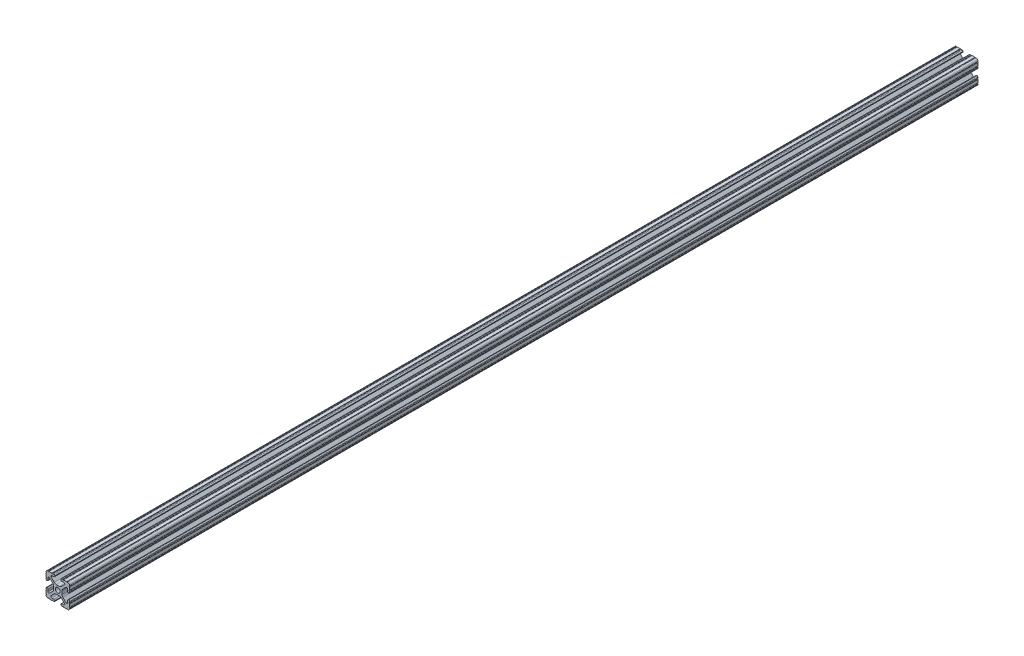
from build123d import *

# Parameters (mm, degrees)
SKETCH1_R           = 2.6035
BOSS_EXTRUDE1_DEPTH = 977.9


with BuildPart() as part:
    # Sketch1 → Boss-Extrude1 (new body)
    with BuildSketch(Plane.XY):
        with BuildLine():
            Line((-7.179650497, -8.645192506), (-3.952270251, -5.423690499))
            ThreePointArc((-3.952270251, -5.423690499), (-2.922936451, -4.736929036), (-1.709253557, -4.4958))
            Line((-1.709253557, -4.4958), (1.709253557, -4.4958))
            ThreePointArc((1.709253557, -4.4958), (2.922936451, -4.736929036), (3.952270251, -5.423690499))
            Line((3.952270251, -5.423690499), (7.179650497, -8.645192506))
            ThreePointArc((7.179650497, -8.645192506), (7.41473083, -9.822813117), (6.416408329, -10.4902))
            Line((6.416408329, -10.4902), (4.287512407, -10.4902))
            ThreePointArc((4.287512407, -10.4902), (3.54574862, -10.79744862), (3.2385, -11.539212407))
            Line((3.2385, -11.539212407), (3.2385, -11.650987593))
            ThreePointArc((3.2385, -11.650987593), (3.54574862, -12.39275138), (4.287512407, -12.7))
            Line((4.287512407, -12.7), (5.317126718, -12.7))
            ThreePointArc((5.317126718, -12.7), (5.825126718, -12.192), (6.333126718, -12.7))
            Line((6.333126718, -12.7), (9.550443118, -12.7))
            ThreePointArc((9.550443118, -12.7), (10.058366869, -12.192000006), (10.566443095, -12.699847501))
            ThreePointArc((10.566443095, -12.699847501), (12.082537762, -12.08250727), (12.699846982, -10.566399977))
            ThreePointArc((12.699846982, -10.566399977), (12.192000006, -10.058323491), (12.7, -9.5504))
            Line((12.7, -9.5504), (12.7, -6.3330836))
            ThreePointArc((12.7, -6.3330836), (12.192, -5.8250836), (12.7, -5.3170836))
            Line((12.7, -5.3170836), (12.7, -4.287469289))
            ThreePointArc((12.7, -4.287469289), (12.39275138, -3.545705502), (11.650987593, -3.238456882))
            Line((11.650987593, -3.238456882), (11.539212407, -3.238456882))
            ThreePointArc((11.539212407, -3.238456882), (10.79744862, -3.545705502), (10.4902, -4.287469289))
            Line((10.4902, -4.287469289), (10.4902, -6.402089023))
            ThreePointArc((10.4902, -6.402089023), (9.856505071, -7.351067942), (8.737131347, -7.129408934))
            Line((8.737131347, -7.129408934), (5.441005833, -3.840816462))
            ThreePointArc((5.441005833, -3.840816462), (4.750877967, -2.809883091), (4.5085, -1.593185507))
            Line((4.5085, -1.593185507), (4.5085, 1.593185507))
            ThreePointArc((4.5085, 1.593185507), (4.750877967, 2.809883091), (5.441005833, 3.840816462))
            Line((5.441005833, 3.840816462), (8.737131347, 7.129408934))
            ThreePointArc((8.737131347, 7.129408934), (9.856505071, 7.351067942), (10.4902, 6.402089023))
            Line((10.4902, 6.402089023), (10.4902, 4.287469289))
            ThreePointArc((10.4902, 4.287469289), (10.79744862, 3.545705502), (11.539212407, 3.238456882))
            Line((11.539212407, 3.238456882), (11.650987593, 3.238456882))
            ThreePointArc((11.650987593, 3.238456882), (12.39275138, 3.545705502), (12.7, 4.287469289))
            Line((12.7, 4.287469289), (12.7, 5.3170836))
            ThreePointArc((12.7, 5.3170836), (12.192, 5.8250836), (12.7, 6.3330836))
            Line((12.7, 6.3330836), (12.7, 9.5504))
            ThreePointArc((12.7, 9.5504), (12.192000006, 10.058323491), (12.699846982, 10.566399977))
            ThreePointArc((12.699846982, 10.566399977), (12.082537762, 12.08250727), (10.566443095, 12.699847501))
            ThreePointArc((10.566443095, 12.699847501), (10.058366869, 12.192000006), (9.550443118, 12.7))
            Line((9.550443118, 12.7), (6.333126718, 12.7))
            ThreePointArc((6.333126718, 12.7), (5.825126718, 12.192), (5.317126718, 12.7))
            Line((5.317126718, 12.7), (4.287512407, 12.7))
            ThreePointArc((4.287512407, 12.7), (3.54574862, 12.39275138), (3.2385, 11.650987593))
            Line((3.2385, 11.650987593), (3.2385, 11.539212407))
            ThreePointArc((3.2385, 11.539212407), (3.54574862, 10.79744862), (4.287512407, 10.4902))
            Line((4.287512407, 10.4902), (6.476788598, 10.4902))
            ThreePointArc((6.476788598, 10.4902), (7.432222385, 9.85140422), (7.207036008, 8.724370562))
            Line((7.207036008, 8.724370562), (3.898272566, 5.423169045))
            ThreePointArc((3.898272566, 5.423169045), (2.869120213, 4.736787962), (1.655778399, 4.4958))
            Line((1.655778399, 4.4958), (-1.655778399, 4.4958))
            ThreePointArc((-1.655778399, 4.4958), (-2.869120213, 4.736787962), (-3.898272566, 5.423169045))
            Line((-3.898272566, 5.423169045), (-7.207036008, 8.724370562))
            ThreePointArc((-7.207036008, 8.724370562), (-7.432222385, 9.85140422), (-6.476788598, 10.4902))
            Line((-6.476788598, 10.4902), (-4.287512407, 10.4902))
            ThreePointArc((-4.287512407, 10.4902), (-3.54574862, 10.79744862), (-3.2385, 11.539212407))
            Line((-3.2385, 11.539212407), (-3.2385, 11.650987593))
            ThreePointArc((-3.2385, 11.650987593), (-3.54574862, 12.39275138), (-4.287512407, 12.7))
            Line((-4.287512407, 12.7), (-5.317126718, 12.7))
            ThreePointArc((-5.317126718, 12.7), (-5.825126718, 12.192), (-6.333126718, 12.7))
            Line((-6.333126718, 12.7), (-9.550443118, 12.7))
            ThreePointArc((-9.550443118, 12.7), (-10.058366869, 12.192000006), (-10.566443095, 12.699847501))
            ThreePointArc((-10.566443095, 12.699847501), (-12.082537762, 12.08250727), (-12.699846982, 10.566399977))
            ThreePointArc((-12.699846982, 10.566399977), (-12.192000006, 10.058323491), (-12.7, 9.5504))
            Line((-12.7, 9.5504), (-12.7, 6.3330836))
            ThreePointArc((-12.7, 6.3330836), (-12.192, 5.8250836), (-12.7, 5.3170836))
            Line((-12.7, 5.3170836), (-12.7, 4.287469289))
            ThreePointArc((-12.7, 4.287469289), (-12.39275138, 3.545705502), (-11.650987593, 3.238456882))
            Line((-11.650987593, 3.238456882), (-11.539212407, 3.238456882))
            ThreePointArc((-11.539212407, 3.238456882), (-10.79744862, 3.545705502), (-10.4902, 4.287469289))
            Line((-10.4902, 4.287469289), (-10.4902, 6.402089023))
            ThreePointArc((-10.4902, 6.402089023), (-9.856505071, 7.351067942), (-8.737131347, 7.129408934))
            Line((-8.737131347, 7.129408934), (-5.441005833, 3.840816462))
            ThreePointArc((-5.441005833, 3.840816462), (-4.750877967, 2.809883091), (-4.5085, 1.593185507))
            Line((-4.5085, 1.593185507), (-4.5085, -1.593185507))
            ThreePointArc((-4.5085, -1.593185507), (-4.750877967, -2.809883091), (-5.441005833, -3.840816462))
            Line((-5.441005833, -3.840816462), (-8.737131347, -7.129408934))
            ThreePointArc((-8.737131347, -7.129408934), (-9.856505071, -7.351067942), (-10.4902, -6.402089023))
            Line((-10.4902, -6.402089023), (-10.4902, -4.287469289))
            ThreePointArc((-10.4902, -4.287469289), (-10.79744862, -3.545705502), (-11.539212407, -3.238456882))
            Line((-11.539212407, -3.238456882), (-11.650987593, -3.238456882))
            ThreePointArc((-11.650987593, -3.238456882), (-12.39275138, -3.545705502), (-12.7, -4.287469289))
            Line((-12.7, -4.287469289), (-12.7, -5.3170836))
            ThreePointArc((-12.7, -5.3170836), (-12.192, -5.8250836), (-12.7, -6.3330836))
            Line((-12.7, -6.3330836), (-12.7, -9.5504))
            ThreePointArc((-12.7, -9.5504), (-12.192000006, -10.058323491), (-12.699846982, -10.566399977))
            ThreePointArc((-12.699846982, -10.566399977), (-12.082537762, -12.08250727), (-10.566443095, -12.699847501))
            ThreePointArc((-10.566443095, -12.699847501), (-10.058366869, -12.192000006), (-9.550443118, -12.7))
            Line((-9.550443118, -12.7), (-6.333126718, -12.7))
            ThreePointArc((-6.333126718, -12.7), (-5.825126718, -12.192), (-5.317126718, -12.7))
            Line((-5.317126718, -12.7), (-4.287512407, -12.7))
            ThreePointArc((-4.287512407, -12.7), (-3.54574862, -12.39275138), (-3.2385, -11.650987593))
            Line((-3.2385, -11.650987593), (-3.2385, -11.539212407))
            ThreePointArc((-3.2385, -11.539212407), (-3.54574862, -10.79744862), (-4.287512407, -10.4902))
            Line((-4.287512407, -10.4902), (-6.416408329, -10.4902))
            ThreePointArc((-6.416408329, -10.4902), (-7.41473083, -9.822813117), (-7.179650497, -8.645192506))
        make_face()
        with Locations(Location((0, 0, 0), (0, 0, 180))):
            Circle(SKETCH1_R, mode=Mode.SUBTRACT)
    extrude(amount=-BOSS_EXTRUDE1_DEPTH)


solid = part.part
